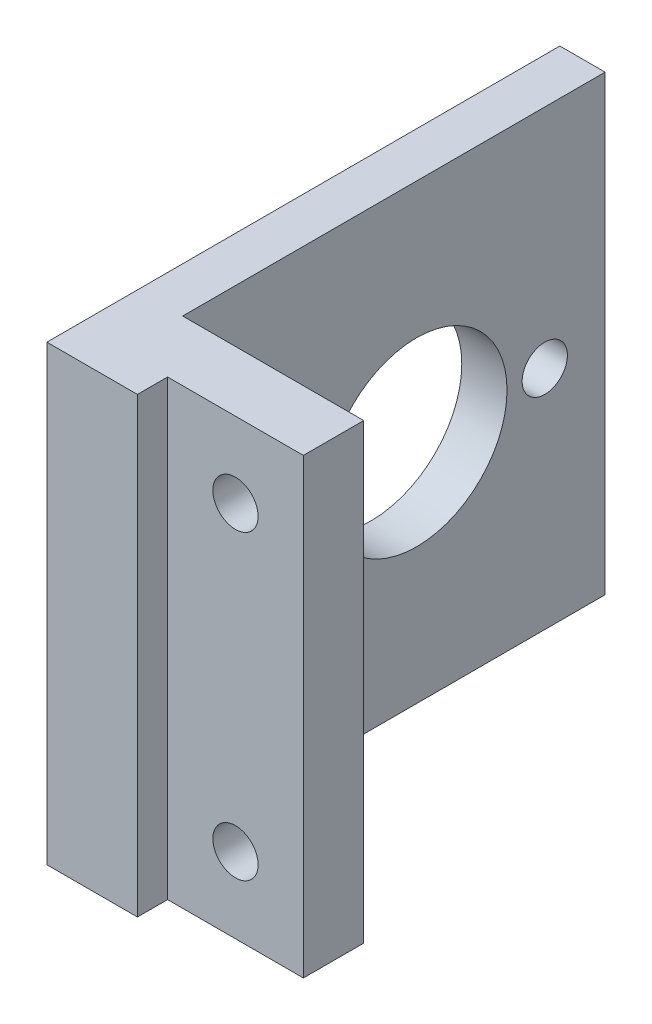
from build123d import *

# Parameters (mm, degrees)
EXTRUDE_1_DEPTH     = 30
SKETCH_2_R          = 6
CUT_EXTRUDE_1_DEPTH = 26
SKETCH_3_W          = 6
SKETCH_3_H          = 30
EXTRUDE_2_DEPTH     = 2
SKETCH_4_R          = 1.5
CUT_EXTRUDE_2_DEPTH = 46.475268004
SKETCH_5_R          = 1.5
CUT_EXTRUDE_3_DEPTH = 47.357307946


with BuildPart() as part:
    # 草图1 → 凸台-拉伸1 (new body)
    with BuildSketch(Plane(origin=(0, 0, 0), x_dir=(1, 0, 0), z_dir=(0, 1, 0))):
        Polygon((0, 0), (15, 0), (15, 4), (3, 4), (3, 32), (0, 32), align=None)
    extrude(amount=EXTRUDE_1_DEPTH)

    # 草图2 → 切除-拉伸1 (cut)
    with BuildSketch(Plane(origin=(3, 0, 0), x_dir=(0, 0, -1), z_dir=(1, 0, 0))):
        with Locations((19.5, 15)):
            Circle(SKETCH_2_R)
    extrude(amount=-CUT_EXTRUDE_1_DEPTH, mode=Mode.SUBTRACT)

    # 草图3 → 凸台-拉伸2 (add)
    with BuildSketch(Plane.XY):
        with Locations((3, 15)):
            Rectangle(SKETCH_3_W, SKETCH_3_H)
    extrude(amount=EXTRUDE_2_DEPTH)

    # 草图4 → 切除-拉伸2 (cut, through all)
    with BuildSketch(Plane(origin=(3, 0, 0), x_dir=(0, 0, -1), z_dir=(1, 0, 0))):
        with Locations((28, 15)):
            Circle(SKETCH_4_R)
        with Locations((11, 15)):
            Circle(SKETCH_4_R)
    extrude(amount=-CUT_EXTRUDE_2_DEPTH, mode=Mode.SUBTRACT)

    # 草图5 → 切除-拉伸3 (cut, through all)
    with BuildSketch(Plane.XY):
        with Locations((10.5, 25)):
            Circle(SKETCH_5_R)
        with Locations((10.5, 5)):
            Circle(SKETCH_5_R)
    extrude(amount=-CUT_EXTRUDE_3_DEPTH, mode=Mode.SUBTRACT)


solid = part.part
